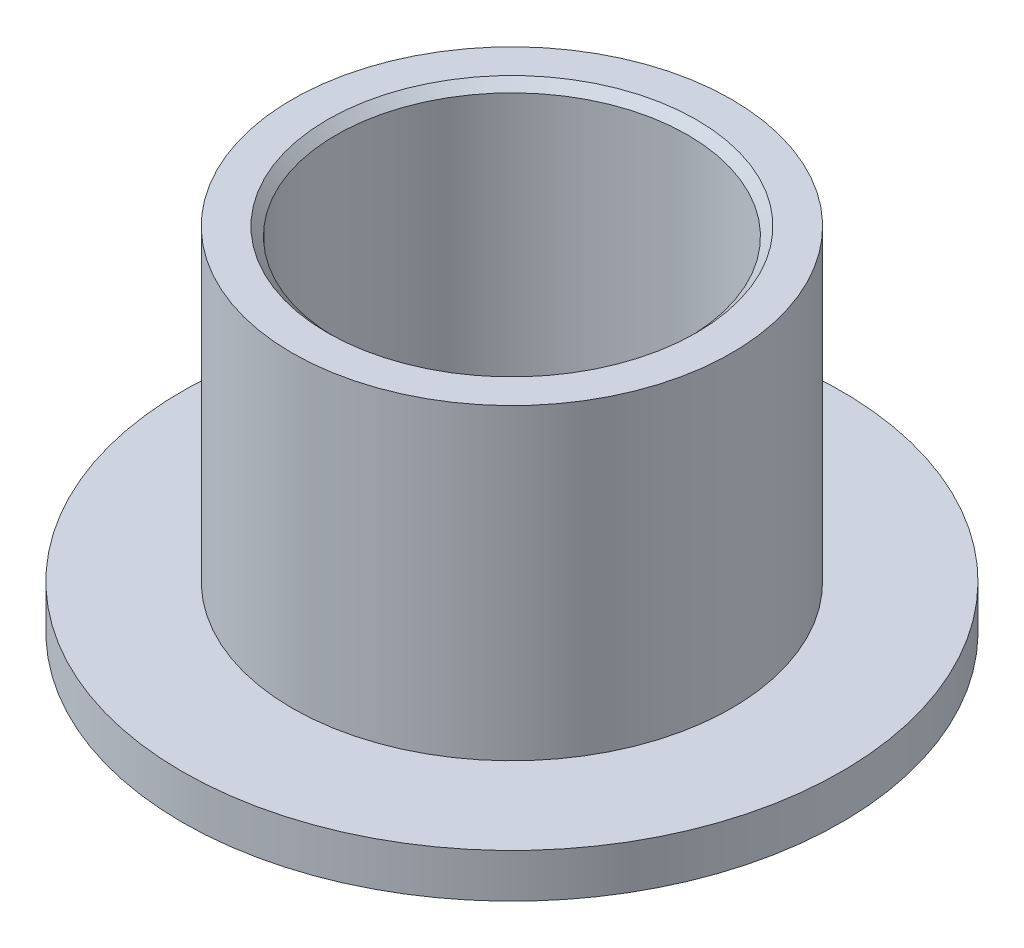
from build123d import *

# Parameters (mm, degrees)
SKIZZE1_R                       = 7.5
AUFSATZ_LINEAR_AUSTRAGEN1_DEPTH = 1
SKIZZE2_R                       = 5
AUFSATZ_LINEAR_AUSTRAGEN2_DEPTH = 7
SKIZZE4_R                       = 4
SCHNITT_LINEAR_AUSTRAGEN1_DEPTH = 14.285330256
FASE1_SIZE                      = 0.2


with BuildPart() as part:
    # Skizze1 → Aufsatz-Linear austragen1 (new body)
    with BuildSketch(Plane(origin=(0, 0, 0), x_dir=(1, 0, 0), z_dir=(0, 1, 0))):
        with Locations(Location((0, 0, 0), (0, 0, 270))):
            Circle(SKIZZE1_R)
    extrude(amount=AUFSATZ_LINEAR_AUSTRAGEN1_DEPTH)

    # Skizze2 → Aufsatz-Linear austragen2 (add)
    with BuildSketch(Plane(origin=(0, 1, 0), x_dir=(1, 0, 0), z_dir=(0, 1, 0))):
        with Locations(Location((0, 0, 0), (0, 0, 270))):
            Circle(SKIZZE2_R)
    extrude(amount=AUFSATZ_LINEAR_AUSTRAGEN2_DEPTH)

    # Skizze4 → Schnitt-Linear austragen1 (cut, through all)
    with BuildSketch(Plane(origin=(0, 8, 0), x_dir=(1, 0, 0), z_dir=(0, 1, 0))):
        with Locations(Location((0, 0, 0), (0, 0, 270))):
            Circle(SKIZZE4_R)
    extrude(amount=-SCHNITT_LINEAR_AUSTRAGEN1_DEPTH, mode=Mode.SUBTRACT)

    # Fase1
    fase1_edges = [part.edges().sort_by_distance(p)[0] for p in [
        (0, 0, -4),
        (0, 8, -4),
    ]]
    chamfer(fase1_edges, length=FASE1_SIZE)


solid = part.part
